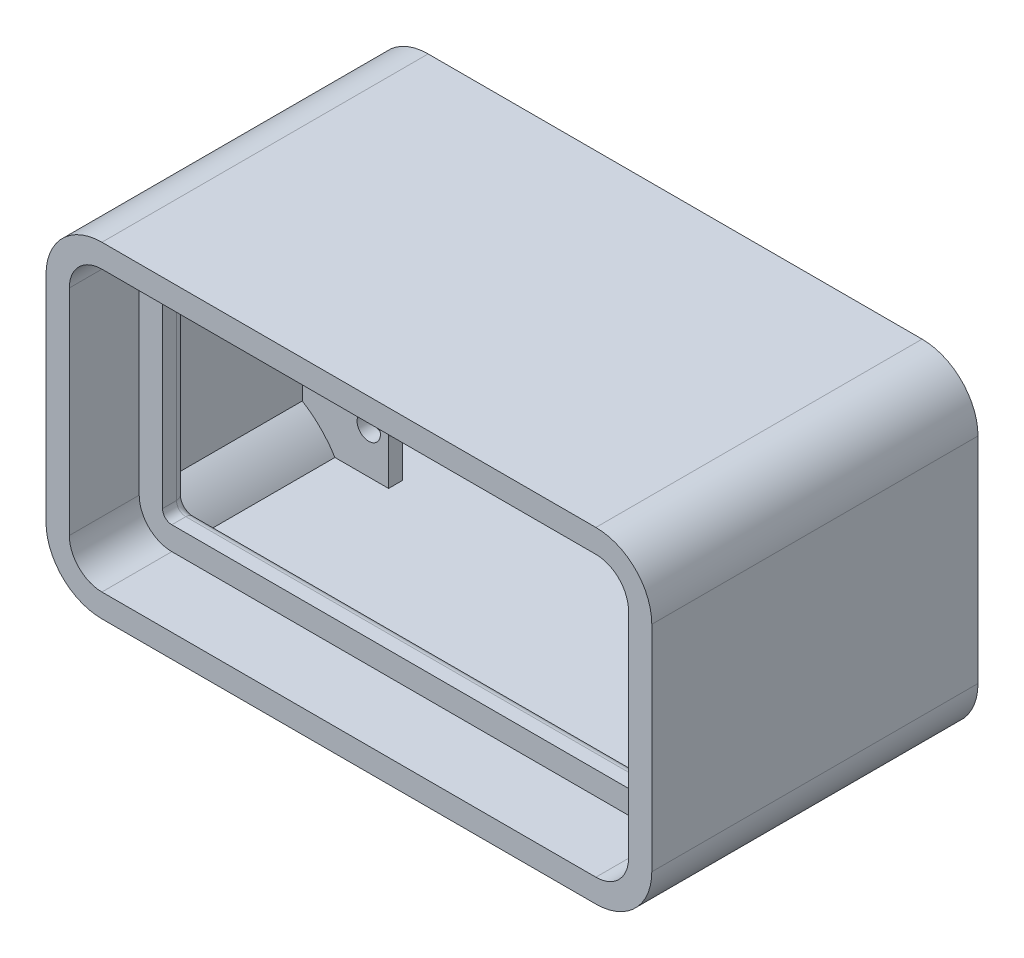
from build123d import *

# Parameters (mm, degrees)
EXTRUDE_1_DEPTH     = 70
CUT_EXTRUDE_1_DEPTH = 70
EXTRUDE_2_DEPTH     = 20
CUT_EXTRUDE_2_DEPTH = 15
EXTRUDE_3_DEPTH     = 50
SKETCH_5_R          = 1.45
CUT_EXTRUDE_3_DEPTH = 15
FILLET_1_R          = 2
EXTRUDE_4_DEPTH     = 3
SKETCH_7_R          = 2.5
CUT_EXTRUDE_4_DEPTH = 4


with BuildPart() as part:
    # Эскиз1 → Бобышка-Вытянуть1 (new body)
    with BuildSketch(Plane.XY):
        with BuildLine():
            Line((-53, 35), (53, 35))
            ThreePointArc((53, 35), (61.485281374, 31.485281374), (65, 23))
            Line((65, 23), (65, -23))
            ThreePointArc((65, -23), (61.485281374, -31.485281374), (53, -35))
            Line((53, -35), (-53, -35))
            ThreePointArc((-53, -35), (-61.485281374, -31.485281374), (-65, -23))
            Line((-65, -23), (-65, 23))
            ThreePointArc((-65, 23), (-61.485281374, 31.485281374), (-53, 35))
        make_face()
    extrude(amount=EXTRUDE_1_DEPTH)

    # Эскиз2 → Вырез-Вытянуть1 (cut)
    with BuildSketch(Plane.XY.offset(70)):
        with BuildLine():
            Line((-53, -30), (53, -30))
            ThreePointArc((53, -30), (57.949747468, -27.949747468), (60, -23))
            Line((60, -23), (60, 23))
            ThreePointArc((60, 23), (57.949747468, 27.949747468), (53, 30))
            Line((53, 30), (-53, 30))
            ThreePointArc((-53, 30), (-57.949747468, 27.949747468), (-60, 23))
            Line((-60, 23), (-60, -23))
            ThreePointArc((-60, -23), (-57.949747468, -27.949747468), (-53, -30))
        make_face()
    extrude(amount=-CUT_EXTRUDE_1_DEPTH, mode=Mode.SUBTRACT)

    # Эскиз3 → Бобышка-Вытянуть2 (add)
    with BuildSketch(Plane.XY.offset(70)):
        with BuildLine():
            Line((-53, -30), (53, -30))
            ThreePointArc((53, -30), (57.949747468, -27.949747468), (60, -23))
            Line((60, -23), (60, 23))
            ThreePointArc((60, 23), (57.949747468, 27.949747468), (53, 30))
            Line((53, 30), (-53, 30))
            ThreePointArc((-53, 30), (-57.949747468, 27.949747468), (-60, 23))
            Line((-60, 23), (-60, -23))
            ThreePointArc((-60, -23), (-57.949747468, -27.949747468), (-53, -30))
        make_face()
        with BuildLine():
            Line((-53, -25), (53, -25))
            ThreePointArc((53, -25), (54.414213562, -24.414213562), (55, -23))
            Line((55, -23), (55, 23))
            ThreePointArc((55, 23), (54.414213562, 24.414213562), (53, 25))
            Line((53, 25), (-53, 25))
            ThreePointArc((-53, 25), (-54.414213562, 24.414213562), (-55, 23))
            Line((-55, 23), (-55, -23))
            ThreePointArc((-55, -23), (-54.414213562, -24.414213562), (-53, -25))
        make_face(mode=Mode.SUBTRACT)
    extrude(amount=-EXTRUDE_2_DEPTH)

    # Эскиз3<2> → Вырез-Вытянуть2 (cut)
    with BuildSketch(Plane.XY.offset(70)):
        with BuildLine():
            Line((-53, -30), (53, -30))
            ThreePointArc((53, -30), (57.949747468, -27.949747468), (60, -23))
            Line((60, -23), (60, 23))
            ThreePointArc((60, 23), (57.949747468, 27.949747468), (53, 30))
            Line((53, 30), (-53, 30))
            ThreePointArc((-53, 30), (-57.949747468, 27.949747468), (-60, 23))
            Line((-60, 23), (-60, -23))
            ThreePointArc((-60, -23), (-57.949747468, -27.949747468), (-53, -30))
        make_face()
        with BuildLine():
            Line((-53, -25), (53, -25))
            ThreePointArc((53, -25), (54.414213562, -24.414213562), (55, -23))
            Line((55, -23), (55, 23))
            ThreePointArc((55, 23), (54.414213562, 24.414213562), (53, 25))
            Line((53, 25), (-53, 25))
            ThreePointArc((-53, 25), (-54.414213562, 24.414213562), (-55, 23))
            Line((-55, 23), (-55, -23))
            ThreePointArc((-55, -23), (-54.414213562, -24.414213562), (-53, -25))
        make_face(mode=Mode.SUBTRACT)
    extrude(amount=-CUT_EXTRUDE_2_DEPTH, mode=Mode.SUBTRACT)

    # Эскиз4 → Бобышка-Вытянуть3 (add)
    with BuildSketch(Plane(origin=(0, 0, 50), x_dir=(-1, 0, 0), z_dir=(0, 0, -1))):
        with BuildLine():
            ThreePointArc((-53, 30), (-56.083662278, 26.083662278), (-60, 23))
            ThreePointArc((-60, 23), (-57.949747468, 27.949747468), (-53, 30))
        make_face()
        with BuildLine():
            ThreePointArc((53, 30), (56.083662278, 26.083662278), (60, 23))
            ThreePointArc((60, 23), (57.949747468, 27.949747468), (53, 30))
        make_face()
        with BuildLine():
            ThreePointArc((53, -30), (57.949747468, -27.949747468), (60, -23))
            ThreePointArc((60, -23), (56.083662278, -26.083662278), (53, -30))
        make_face()
        with BuildLine():
            ThreePointArc((-53, -30), (-56.083662278, -26.083662278), (-60, -23))
            ThreePointArc((-60, -23), (-57.949747468, -27.949747468), (-53, -30))
        make_face()
    extrude(amount=EXTRUDE_3_DEPTH)

    # Эскиз5 → Вырез-Вытянуть3 (cut)
    with BuildSketch(Plane(origin=(0, 0, 0), x_dir=(-1, 0, 0), z_dir=(0, 0, -1))):
        with Locations((-58.865243762, 28.354943792)):
            Circle(SKETCH_5_R)
        with Locations((58.865243762, 28.354943792)):
            Circle(SKETCH_5_R)
        with Locations((58.865243762, -28.354943792)):
            Circle(SKETCH_5_R)
        with Locations((-58.865243762, -28.354943792)):
            Circle(SKETCH_5_R)
    extrude(amount=-CUT_EXTRUDE_3_DEPTH, mode=Mode.SUBTRACT)

    # Скругление1
    fillet_1_edges = [part.edges().sort_by_distance(p)[0] for p in [
        (54.414213562, -24.414213562, 50),
        (0, -25, 50),
        (-54.414213562, -24.414213562, 50),
        (-55, 0, 50),
        (-54.414213562, 24.414213562, 50),
        (0, 25, 50),
        (54.414213562, 24.414213562, 50),
        (55, 0, 50),
    ]]
    fillet(fillet_1_edges, radius=FILLET_1_R)

    # Эскиз6 → Бобышка-Вытянуть4 (add)
    with BuildSketch(Plane(origin=(0, 0, 20), x_dir=(-1, 0, 0), z_dir=(0, 0, -1))):
        with BuildLine():
            Line((61.485281374, 31.485281374), (41.485281374, 31.485281374))
            Line((41.485281374, 31.485281374), (41.485281374, 20.485281374))
            ThreePointArc((41.485281374, 20.485281374), (42.949747468, 16.949747468), (46.485281374, 15.485281374))
            Line((46.485281374, 15.485281374), (61.485281374, 15.485281374))
            Line((61.485281374, 15.485281374), (61.485281374, 31.485281374))
        make_face()
        with BuildLine():
            Line((-61.485281374, 15.485281374), (-46.485281374, 15.485281374))
            ThreePointArc((-46.485281374, 15.485281374), (-42.949747468, 16.949747468), (-41.485281374, 20.485281374))
            Line((-41.485281374, 20.485281374), (-41.485281374, 31.485281374))
            Line((-41.485281374, 31.485281374), (-61.485281374, 31.485281374))
            Line((-61.485281374, 31.485281374), (-61.485281374, 15.485281374))
        make_face()
        with BuildLine():
            Line((-61.485281374, -31.485281374), (-61.485281374, -15.485281374))
            Line((-61.485281374, -15.485281374), (-46.485281374, -15.485281374))
            ThreePointArc((-46.485281374, -15.485281374), (-42.949747468, -16.949747468), (-41.485281374, -20.485281374))
            Line((-41.485281374, -20.485281374), (-41.485281374, -31.485281374))
            Line((-41.485281374, -31.485281374), (-61.485281374, -31.485281374))
        make_face()
        with BuildLine():
            Line((61.485281374, -15.485281374), (46.485281374, -15.485281374))
            ThreePointArc((46.485281374, -15.485281374), (42.949747468, -16.949747468), (41.485281374, -20.485281374))
            Line((41.485281374, -20.485281374), (41.485281374, -31.485281374))
            Line((41.485281374, -31.485281374), (61.485281374, -31.485281374))
            Line((61.485281374, -31.485281374), (61.485281374, -15.485281374))
        make_face()
    extrude(amount=EXTRUDE_4_DEPTH)

    # Эскиз7 → Вырез-Вытянуть4 (cut)
    with BuildSketch(Plane(origin=(0, 0, 17), x_dir=(-1, 0, 0), z_dir=(0, 0, -1))):
        with Locations((-46.054090748, 20.935782702)):
            Circle(SKETCH_7_R)
        with Locations((45.745909252, 20.935782702)):
            Circle(SKETCH_7_R)
        with Locations((45.745909252, -20.864217298)):
            Circle(SKETCH_7_R)
        with Locations((-46.054090748, -20.864217298)):
            Circle(SKETCH_7_R)
    extrude(amount=-CUT_EXTRUDE_4_DEPTH, mode=Mode.SUBTRACT)


solid = part.part
